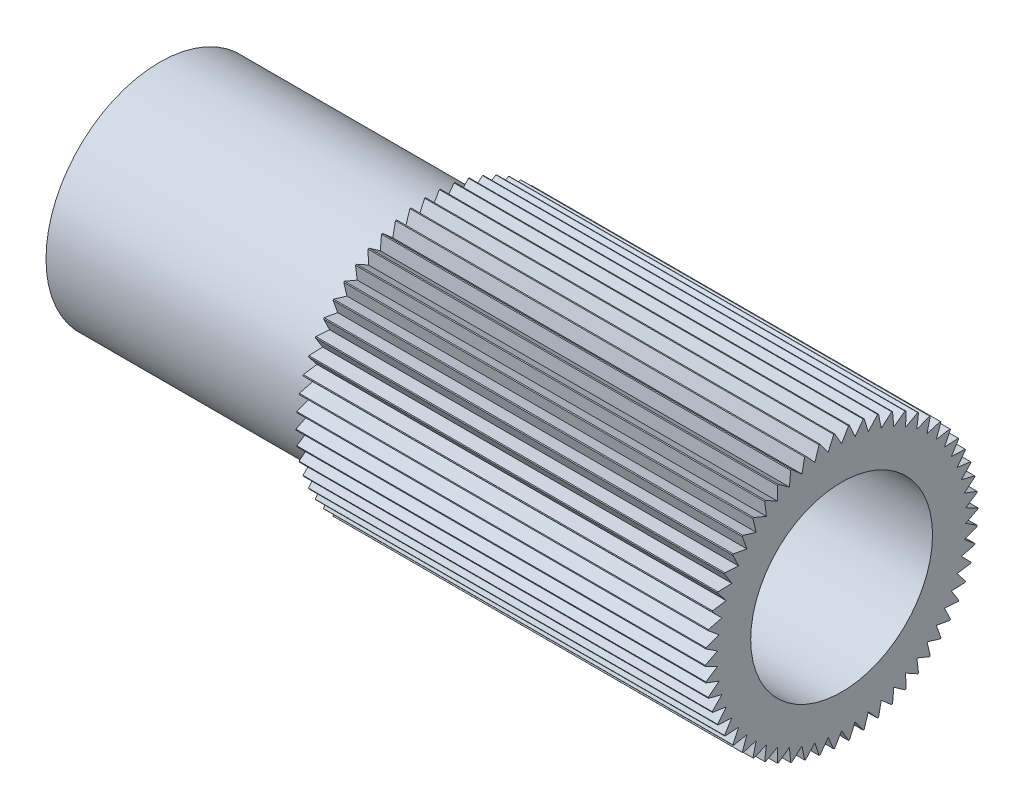
from build123d import *

# Parameters (mm, degrees)
CROQUIS1_R     = 1.5
EXTRUIR1_DEPTH = 4.5
CROQUIS3_R     = 1.25
EXTRUIR2_DEPTH = 3
CROQUIS4_R     = 1
EXTRUIR3_DEPTH = 4
EXTRUIR5_DEPTH = 8.794228634
MATRIZC1_COUNT = 58


with BuildPart() as part:
    # Croquis1 → Extruir1 (new body)
    with BuildSketch(Plane(origin=(0, 0, 0), x_dir=(0, 0, -1), z_dir=(1, 0, 0))):
        Circle(CROQUIS1_R)
    extrude(amount=EXTRUIR1_DEPTH)

    # Croquis3 → Extruir2 (add)
    with BuildSketch(Plane.ZY):
        with Locations(Location((0, 0, 0), (0, 0, 180))):
            Circle(CROQUIS3_R)
    extrude(amount=EXTRUIR2_DEPTH)

    # Croquis4 → Extruir3 (cut)
    with BuildSketch(Plane(origin=(4.5, 0, 0), x_dir=(0, 0, -1), z_dir=(1, 0, 0))):
        Circle(CROQUIS4_R)
    extrude(amount=-EXTRUIR3_DEPTH, mode=Mode.SUBTRACT)

    # Croquis6 → Extruir5 (cut, through all)
    with BuildSketch(Plane(origin=(4.5, 0, 0), x_dir=(0, 0, -1), z_dir=(1, 0, 0))):
        with BuildLine():
            Line((0, 1.36653049), (-0.075895771, 1.498078714))
            ThreePointArc((-0.075895771, 1.498078714), (5.2181e-05, 1.499999999), (0.076, 1.498073429))
            Line((0.076, 1.498073429), (0, 1.36653049))
        make_face()
    extruir5 = extrude(amount=-EXTRUIR5_DEPTH, mode=Mode.SUBTRACT)

    # MatrizC1: Extruir5 ×58 about axis
    matrizc1_axis = Axis((0, 0, 0), (1, 0, 0))
    for i in range(1, MATRIZC1_COUNT):
        add(extruir5.rotate(matrizc1_axis, i * 360 / MATRIZC1_COUNT), mode=Mode.SUBTRACT)


solid = part.part
